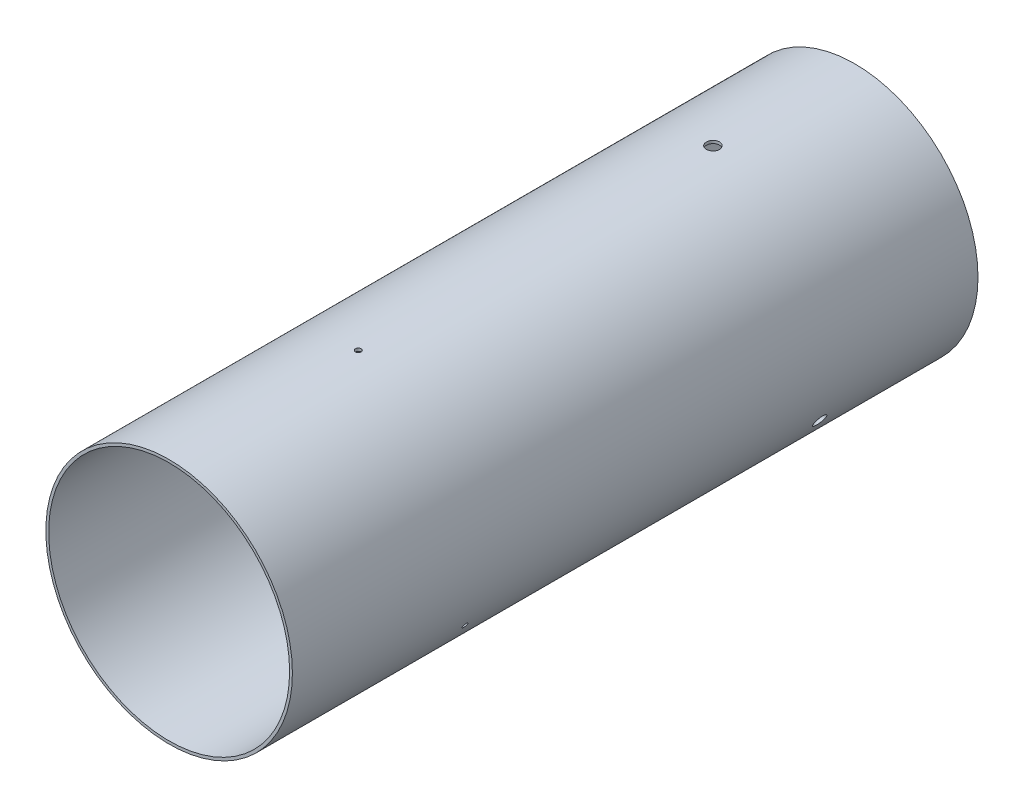
from build123d import *

# Parameters (mm, degrees)
SKETCH1_R                = 49.6697
SKETCH1_R_2              = 48.5394
BOSS_EXTRUDE1_DEPTH      = 276.225
SKETCH2_R                = 2.6289
SKETCH2_R_2              = 1.143
F_8_32_T_NUT_HOLES_DEPTH = 5.08
CIRPATTERN1_COUNT        = 3


with BuildPart() as part:
    # Sketch1 → Boss-Extrude1 (new body)
    with BuildSketch(Plane.XY):
        Circle(SKETCH1_R)
        Circle(SKETCH1_R_2, mode=Mode.SUBTRACT)
    extrude(amount=BOSS_EXTRUDE1_DEPTH)

    # Sketch2 → 8-32 T-Nut Holes (cut)
    with BuildSketch(Plane(origin=(0, 49.6697, 0), x_dir=(1, 0, 0), z_dir=(0, 1, 0))):
        with Locations(Location((0, -57.15, 0), (0, 0, 270))):
            Circle(SKETCH2_R)
        with Locations(Location((0, -200.025, 0), (0, 0, 270))):
            Circle(SKETCH2_R_2)
    f_8_32_t_nut_holes = extrude(amount=-F_8_32_T_NUT_HOLES_DEPTH, mode=Mode.SUBTRACT)

    # CirPattern1: 8-32 T-Nut Holes ×3 about axis
    cirpattern1_axis = Axis((0, 0, 276.225), (0, 0, -1))
    for i in range(1, CIRPATTERN1_COUNT):
        add(f_8_32_t_nut_holes.rotate(cirpattern1_axis, i * 360 / CIRPATTERN1_COUNT), mode=Mode.SUBTRACT)


solid = part.part
